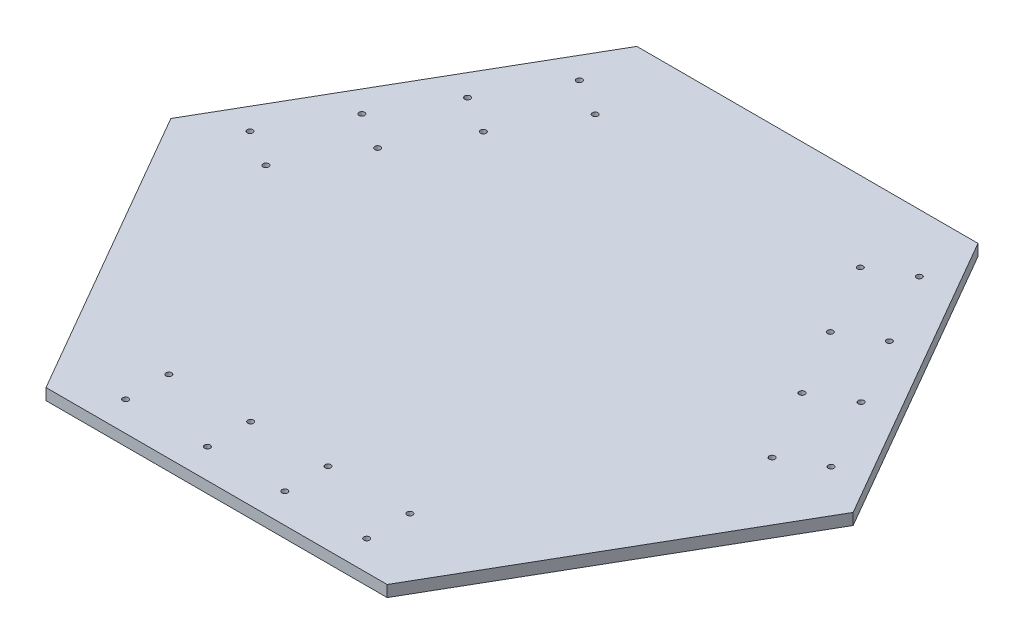
from build123d import *

# Parameters (mm, degrees)
BOSS_EXTRUDE1_DEPTH   = 5
M3X0_5_TAPPED_HOLE3_D = 2.5
CIRPATTERN3_COUNT     = 3
CIRPATTERN3_COPY_1_D  = 2.5
CIRPATTERN3_COPY_2_D  = 2.5


with BuildPart() as part:
    # Sketch1 → Boss-Extrude1 (new body)
    with BuildSketch(Plane(origin=(0, 0, 0), x_dir=(1, 0, 0), z_dir=(0, 1, 0))):
        Polygon((150, 0), (75, 129.903810568), (-75, 129.903810568), (-150, 0), (-75, -129.903810568), (75, -129.903810568), align=None)
    extrude(amount=BOSS_EXTRUDE1_DEPTH)

    # M3x0.5 Tapped Hole3 (through all)
    with Locations(Plane(origin=(0, 5, 0), x_dir=(1, 0, 0), z_dir=(0, 1, 0))):
        with Locations((-53, -97.903810568), (-17, -97.903810568), (-17, -116.903810568), (-53, -116.903810568)):
            m3x0_5_tapped_hole3 = Hole(M3X0_5_TAPPED_HOLE3_D / 2)

    # Mirror5: M3x0.5 Tapped Hole3 across Right Plane
    add(m3x0_5_tapped_hole3.mirror(Plane(origin=(0, 0, 0), x_dir=(0, 0, -1), z_dir=(1, 0, 0))), mode=Mode.SUBTRACT)

    # CirPattern3: M3x0.5 Tapped Hole3 ×3 about axis
    cirpattern3_axis = Axis((0, 0, 0), (0, 1, 0))
    for i in range(1, CIRPATTERN3_COUNT):
        add(m3x0_5_tapped_hole3.rotate(cirpattern3_axis, i * 360 / CIRPATTERN3_COUNT), mode=Mode.SUBTRACT)

    # CirPattern3 copy 1 (through all)
    with Locations(Plane(origin=(0, 5, 0), x_dir=(0.4999999999999998, 0, 0.8660254037844387), z_dir=(0, 1, 0))):
        with Locations((-53, 97.903810568), (-17, 97.903810568), (-17, 116.903810568), (-53, 116.903810568)):
            Hole(CIRPATTERN3_COPY_1_D / 2)

    # CirPattern3 copy 2 (through all)
    with Locations(Plane(origin=(0, 5, 0), x_dir=(0.5000000000000004, 0, -0.8660254037844384), z_dir=(0, 1, 0))):
        with Locations((-53, 97.903810568), (-17, 97.903810568), (-17, 116.903810568), (-53, 116.903810568)):
            Hole(CIRPATTERN3_COPY_2_D / 2)


solid = part.part
